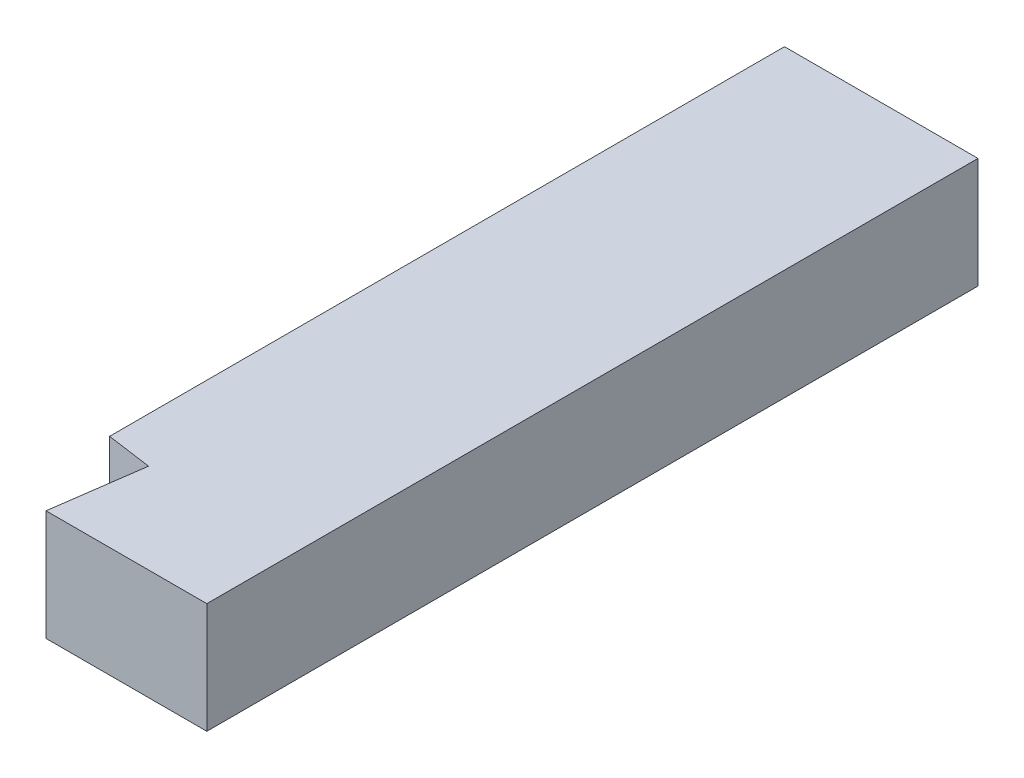
from build123d import *

# Parameters (mm, degrees)
SKETCH1_W               = 101.6
SKETCH1_H               = 50.8
BOSS_EXTRUDE1_DEPTH     = 354.289954614
CUT_EXTRUDE1_DEPTH      = 362.500555934
CUT_EXTRUDE1_DEPTH_BACK = 362.500555934
CUT_EXTRUDE2_DEPTH      = 362.500555934
CUT_EXTRUDE2_DEPTH_BACK = 362.500555934
SKETCH3_W               = 12.7
SKETCH3_H               = 354.289954614


with BuildPart() as part:
    # Sketch1 → Boss-Extrude1 (new body)
    with BuildSketch(Plane.XY):
        Rectangle(SKETCH1_W, SKETCH1_H)
    extrude(amount=BOSS_EXTRUDE1_DEPTH)

    # Sketch2 → Cut-Extrude1 (cut, two sides: drawn at the far end of the back side and taken through both)
    with BuildSketch(Plane(origin=(0, 25.4, 0), x_dir=(1, 0, 0), z_dir=(0, 1, 0)).offset(-CUT_EXTRUDE1_DEPTH_BACK)):
        Polygon((-50.8, -322.885251713), (-50.8, -310.060441542), (-29.982501618, -312.986150141), (-31.75, -325.562554614), (-35.787372775, -354.289954614), (-50.8, -354.289954614), align=None)
    extrude(amount=CUT_EXTRUDE1_DEPTH + CUT_EXTRUDE1_DEPTH_BACK, mode=Mode.SUBTRACT)

    # Sketch3 → Cut-Extrude2 (cut, two sides: drawn at the far end of the back side and taken through both)
    with BuildSketch(Plane(origin=(0, 25.4, 0), x_dir=(1, 0, 0), z_dir=(0, 1, 0)).offset(-CUT_EXTRUDE2_DEPTH_BACK)):
        with Locations((44.45, -177.144977307)):
            Rectangle(SKETCH3_W, SKETCH3_H)
    extrude(amount=CUT_EXTRUDE2_DEPTH + CUT_EXTRUDE2_DEPTH_BACK, mode=Mode.SUBTRACT)


solid = part.part
